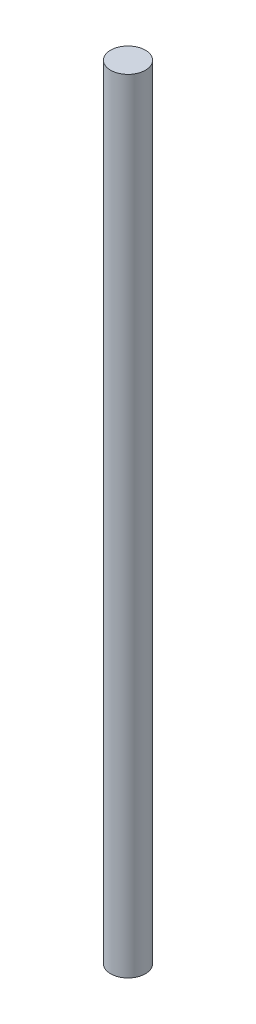
from build123d import *

# Parameters (mm, degrees)
SKETCH1_R           = 1
BOSS_EXTRUDE1_DEPTH = 45


with BuildPart() as part:
    # Sketch1 → Boss-Extrude1 (new body)
    with BuildSketch(Plane(origin=(0, 0, 0), x_dir=(1, 0, 0), z_dir=(0, 1, 0))):
        with Locations(Location((0, 0, 0), (0, 0, 90))):
            Circle(SKETCH1_R)
    extrude(amount=BOSS_EXTRUDE1_DEPTH)


solid = part.part
